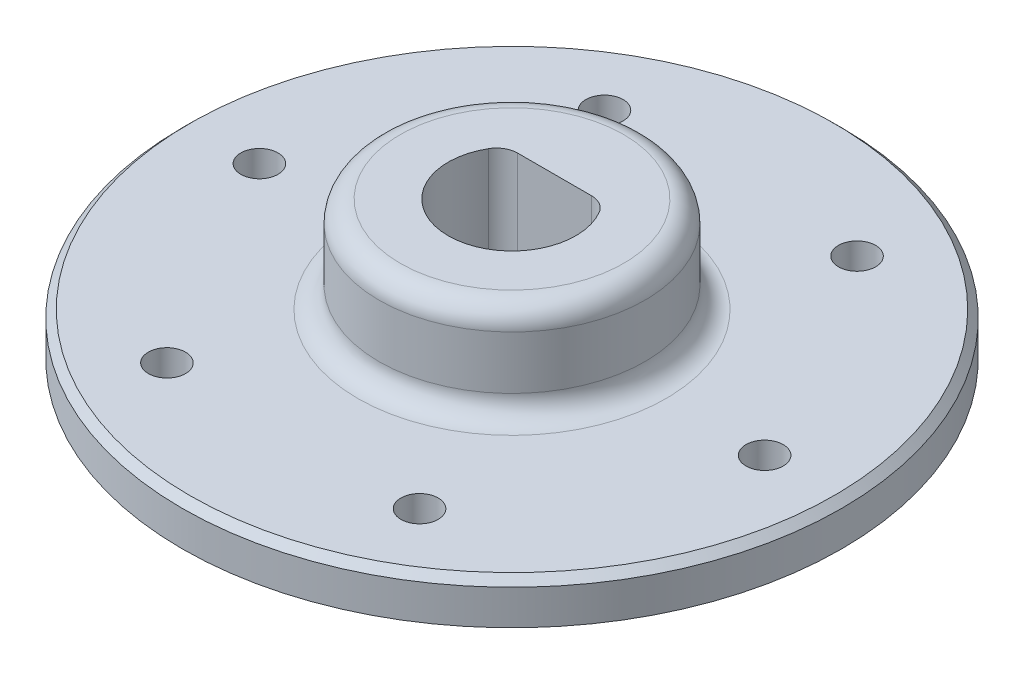
from build123d import *

# Parameters (mm, degrees)
SKETCH1_R           = 31
SKETCH1_R_2         = 1.75
BOSS_EXTRUDE1_DEPTH = 4
SKETCH2_R           = 12.5
BOSS_EXTRUDE2_DEPTH = 9
FILLET2_R           = 2
CHAMFER2_SIZE       = 0.7
SKETCH6_R           = 11.5
BOSS_EXTRUDE3_DEPTH = 9
FILLET3_R           = 2
CUT_EXTRUDE3_DEPTH  = 50.050993874
FILLET4_R           = 2


with BuildPart() as part:
    # Sketch1 → Boss-Extrude1 (new body)
    with BuildSketch(Plane(origin=(0, 0, 0), x_dir=(1, 0, 0), z_dir=(0, 1, 0))):
        with Locations(Location((0, 0, 0), (0, 0, 270))):
            Circle(SKETCH1_R)
        with Locations(Location((-11.875, 20.56810334, 0), (0, 0, 270))):
            Circle(SKETCH1_R_2, mode=Mode.SUBTRACT)
        with Locations(Location((11.875, 20.56810334, 0), (0, 0, 270))):
            Circle(SKETCH1_R_2, mode=Mode.SUBTRACT)
        with Locations(Location((23.75, 0, 0), (0, 0, 270))):
            Circle(SKETCH1_R_2, mode=Mode.SUBTRACT)
        with Locations(Location((11.875, -20.56810334, 0), (0, 0, 270))):
            Circle(SKETCH1_R_2, mode=Mode.SUBTRACT)
        with Locations(Location((-11.875, -20.56810334, 0), (0, 0, 270))):
            Circle(SKETCH1_R_2, mode=Mode.SUBTRACT)
        with Locations(Location((-23.75, 0, 0), (0, 0, 270))):
            Circle(SKETCH1_R_2, mode=Mode.SUBTRACT)
    extrude(amount=BOSS_EXTRUDE1_DEPTH)

    # Sketch2 → Boss-Extrude2 (add)
    with BuildSketch(Plane(origin=(0, 4, 0), x_dir=(1, 0, 0), z_dir=(0, 1, 0))):
        with Locations(Location((0, 0, 0), (0, 0, 270))):
            Circle(SKETCH2_R)
    extrude(amount=BOSS_EXTRUDE2_DEPTH)

    # Fillet2
    fillet2_edges = [part.edges().sort_by_distance(p)[0] for p in [
        (0, 4, -12.5),
        (0, 13, -12.5),
    ]]
    fillet(fillet2_edges, radius=FILLET2_R)

    # Chamfer2
    chamfer2_edges = [part.edges().sort_by_distance(p)[0] for p in [
        (0, 4, -31),
    ]]
    chamfer(chamfer2_edges, length=CHAMFER2_SIZE)

    # Sketch6 → Boss-Extrude3 (add)
    with BuildSketch(Plane(origin=(0, 0, 0), x_dir=(-1, 0, 0), z_dir=(0, -1, 0))):
        with Locations(Location((0, 0, 0), (0, 0, 270))):
            Circle(SKETCH6_R)
    extrude(amount=BOSS_EXTRUDE3_DEPTH)

    # Fillet3
    fillet3_edges = [part.edges().sort_by_distance(p)[0] for p in [
        (0, -9, -11.5),
    ]]
    fillet(fillet3_edges, radius=FILLET3_R)

    # Sketch7 → Cut-Extrude3 (cut, through all)
    with BuildSketch(Plane(origin=(0, -9, 0), x_dir=(-1, 0, 0), z_dir=(0, -1, 0))):
        with BuildLine():
            Line((4.472135955, 4), (-4.472135955, 4))
            ThreePointArc((-4.472135955, 4), (0, -6), (4.472135955, 4))
        make_face()
    extrude(amount=-CUT_EXTRUDE3_DEPTH, mode=Mode.SUBTRACT)

    # Fillet4
    fillet4_edges = [part.edges().sort_by_distance(p)[0] for p in [
        (-4.472135955, 2, -4),
        (4.472135955, 2, -4),
    ]]
    fillet(fillet4_edges, radius=FILLET4_R)


solid = part.part
